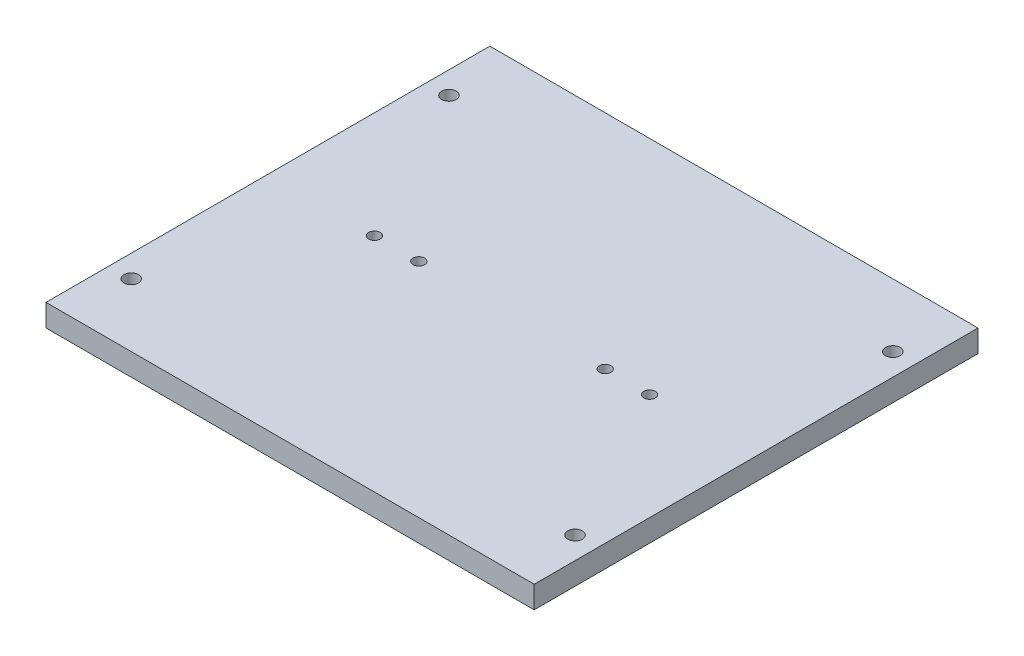
from build123d import *

# Parameters (mm, degrees)
SKETCH1_W           = 139.7
SKETCH1_H           = 127
SKETCH1_R           = 2.0828
SKETCH1_R_2         = 1.651
BOSS_EXTRUDE1_DEPTH = 6.35


with BuildPart() as part:
    # Sketch1 → Boss-Extrude1 (new body)
    with BuildSketch(Plane(origin=(0, 0, 0), x_dir=(1, 0, 0), z_dir=(0, 1, 0))):
        with Locations((69.85, 127)):
            Rectangle(SKETCH1_W, SKETCH1_H)
        with Locations(Location((133.35, 172.466, 0), (0, 0, 270))):
            Circle(SKETCH1_R, mode=Mode.SUBTRACT)
        with Locations(Location((133.35, 81.534, 0), (0, 0, 90))):
            Circle(SKETCH1_R, mode=Mode.SUBTRACT)
        with Locations(Location((6.35, 172.466, 0), (0, 0, 90))):
            Circle(SKETCH1_R, mode=Mode.SUBTRACT)
        with Locations(Location((6.35, 81.534, 0), (0, 0, 270))):
            Circle(SKETCH1_R, mode=Mode.SUBTRACT)
        with Locations(Location((43.18, 127, 0), (0, 0, 90))):
            Circle(SKETCH1_R_2, mode=Mode.SUBTRACT)
        with Locations(Location((109.22, 127, 0), (0, 0, 270))):
            Circle(SKETCH1_R_2, mode=Mode.SUBTRACT)
        with Locations(Location((96.52, 127, 0), (0, 0, 270))):
            Circle(SKETCH1_R_2, mode=Mode.SUBTRACT)
        with Locations(Location((30.48, 127, 0), (0, 0, 90))):
            Circle(SKETCH1_R_2, mode=Mode.SUBTRACT)
    extrude(amount=BOSS_EXTRUDE1_DEPTH)


solid = part.part
